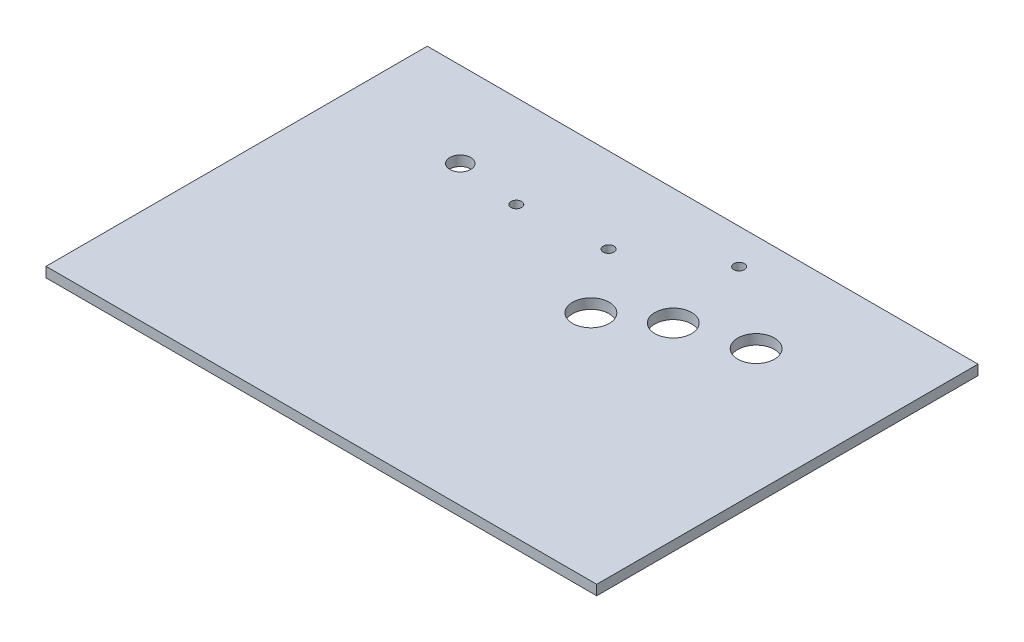
from build123d import *

# Parameters (mm, degrees)
SKETCH1_W           = 330.2
SKETCH1_H           = 228.6
BOSS_EXTRUDE1_DEPTH = 6
SKETCH2_R           = 6.25
SKETCH2_R_2         = 3.175
SKETCH2_R_3         = 11
CUT_EXTRUDE1_DEPTH  = 402.654080024


with BuildPart() as part:
    # Sketch1 → Boss-Extrude1 (new body)
    with BuildSketch(Plane(origin=(0, 0, 0), x_dir=(1, 0, 0), z_dir=(0, 1, 0))):
        with Locations((165.1, 114.3)):
            Rectangle(SKETCH1_W, SKETCH1_H)
    extrude(amount=BOSS_EXTRUDE1_DEPTH)

    # Sketch2 → Cut-Extrude1 (cut, through all)
    with BuildSketch(Plane(origin=(0, 6, 0), x_dir=(1, 0, 0), z_dir=(0, 1, 0))):
        with Locations(Location((70.8, 177.6, 0), (0, 0, 270))):
            Circle(SKETCH2_R)
        with Locations(Location((108.9, 173.1, 0), (0, 0, 270))):
            Circle(SKETCH2_R_2)
        with Locations(Location((159.7, 177.6, 0), (0, 0, 270))):
            Circle(SKETCH2_R_2)
        with Locations(Location((207.96, 207.6, 0), (0, 0, 270))):
            Circle(SKETCH2_R_2)
        with Locations(Location((187.5, 139.2, 0), (0, 0, 270))):
            Circle(SKETCH2_R_3)
        with Locations(Location((217.5, 158.6, 0), (0, 0, 270))):
            Circle(SKETCH2_R_3)
        with Locations(Location((255.6, 170.18, 0), (0, 0, 270))):
            Circle(SKETCH2_R_3)
    extrude(amount=-CUT_EXTRUDE1_DEPTH, mode=Mode.SUBTRACT)


solid = part.part
